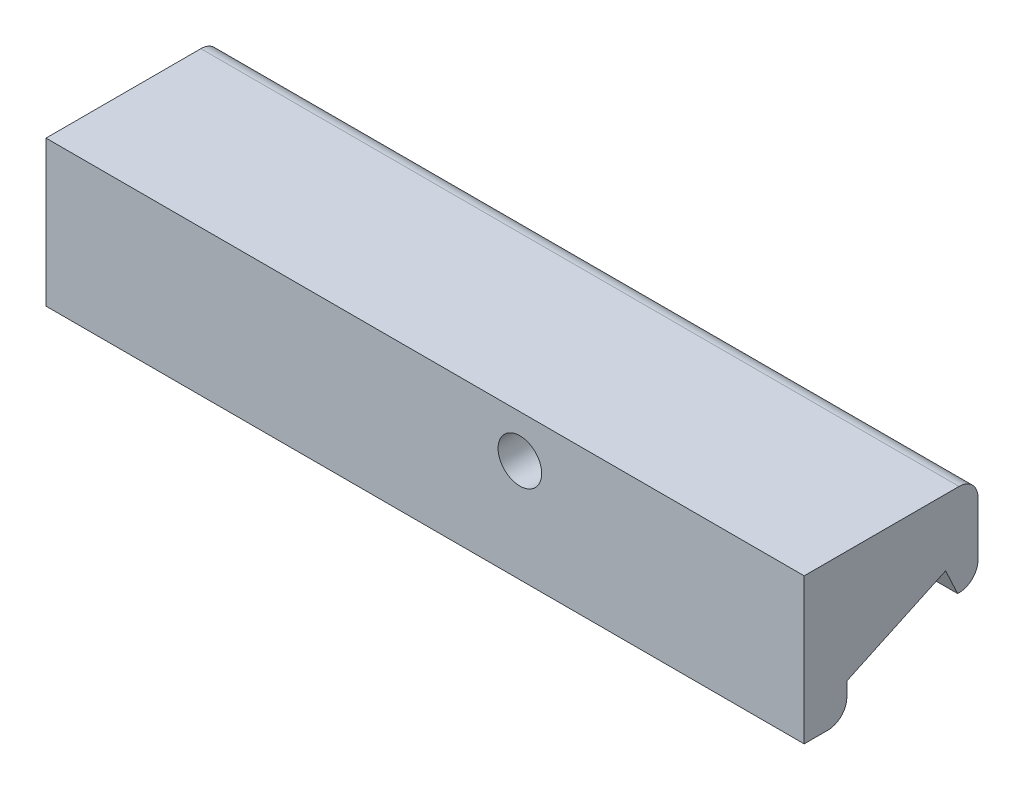
from build123d import *

# Parameters (mm, degrees)
PROFILEBOSS_EXTRUDE1_DEPTH           = 80
SKETCH2_R                            = 2.3
LEDSTRIPMOUNTHOLESCUT_EXTRUDE1_DEPTH = 4.5
SKETCH3_R                            = 2.3
MOUNTINGHOLESCUT_EXTRUDE3_DEPTH      = 4.5


with BuildPart() as part:
    # Sketch1 → ProfileBoss-Extrude1 (new body)
    with BuildSketch(Plane(origin=(0, 0, 0), x_dir=(0, 0, -1), z_dir=(1, 0, 0))):
        with BuildLine():
            Line((0, 0), (2.499461553, 0))
            ThreePointArc((2.499461553, 0), (3.914055855, 0.585944145), (4.5, 2.000538447))
            Line((4.5, 2.000538447), (4.5, 3.5))
            Line((4.5, 3.5), (14.922539551, 8.36011001))
            Line((14.922539551, 8.36011001), (16.190394336, 5.641186649))
            ThreePointArc((16.190394336, 5.641186649), (17.700753359, 6.16912635), (18.340729536, 7.635528477))
            Line((18.340729536, 7.635528477), (18.340729536, 13.36011001))
            ThreePointArc((18.340729536, 13.36011001), (17.754943098, 14.774323572), (16.340729536, 15.36011001))
            Line((16.340729536, 15.36011001), (0, 15.36011001))
            Line((0, 15.36011001), (0, 0))
        make_face()
    extrude(amount=PROFILEBOSS_EXTRUDE1_DEPTH)

    # Sketch2 → LedStripMountHolesCut-Extrude1 (cut)
    with BuildSketch(Plane(origin=(0, 1.15127832, 0.536849897), x_dir=(1, 0, 0), z_dir=(0, -0.906307787036651, -0.4226182617406973))):
        with Locations(Location((36.15, -11.307548958, 0), (0, 0, 270))):
            Circle(SKETCH2_R)
    extrude(amount=-LEDSTRIPMOUNTHOLESCUT_EXTRUDE1_DEPTH, mode=Mode.SUBTRACT)

    # Sketch3 → MountingHolesCut-Extrude3 (cut)
    with BuildSketch(Plane.XY):
        with Locations((50, 10.86011001)):
            Circle(SKETCH3_R)
    extrude(amount=-MOUNTINGHOLESCUT_EXTRUDE3_DEPTH, mode=Mode.SUBTRACT)


solid = part.part
